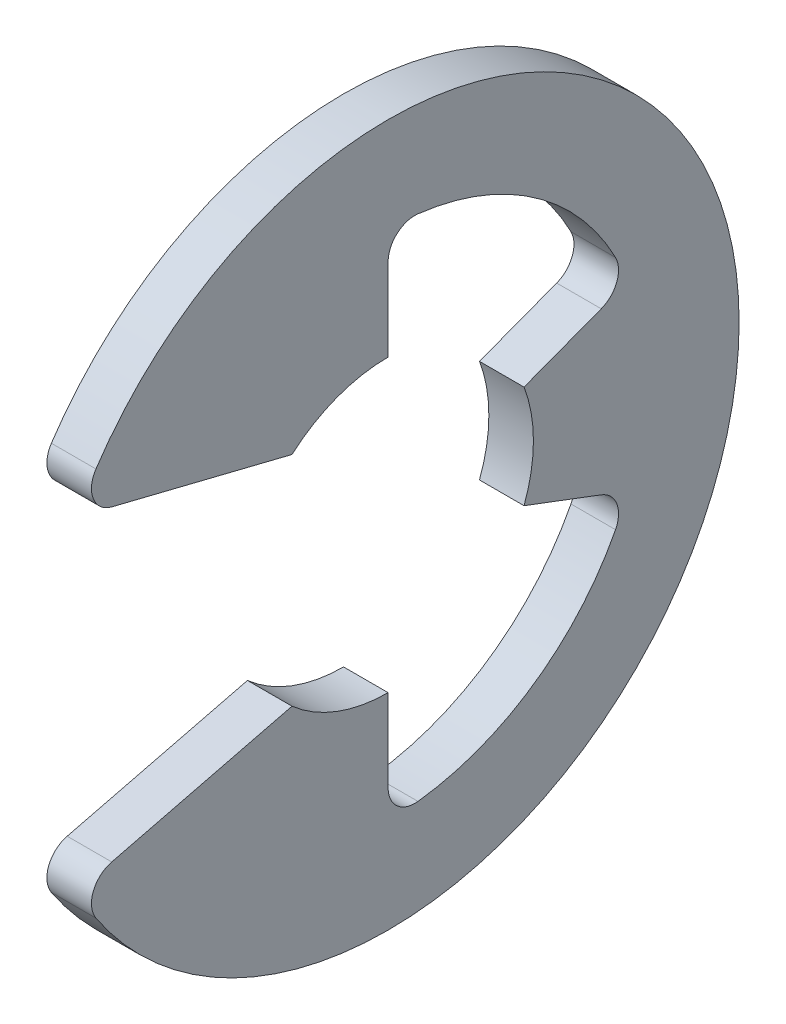
from build123d import *

# Parameters (mm, degrees)
EXTRUDE1_DEPTH = 0.5
FILLET1_R      = 0.6


with BuildPart() as part:
    # Sketch1 → Extrude1 (new, symmetric)
    with BuildSketch(Plane(origin=(0, 0, 0), x_dir=(0, 0, -1), z_dir=(1, 0, 0))):
        with BuildLine():
            Line((-6.981705618, -3.642994877), (-2.156287319, -2.445))
            ThreePointArc((-2.156287319, -2.445), (-1.152584053, -3.04945077), (0, -3.26))
            Line((0, -3.26), (0, -5.747096774))
            ThreePointArc((0, -5.747096774), (3.267381482, -4.727931851), (5.375916774, -2.031905551))
            Line((5.375916774, -2.031905551), (3.04945077, -1.152584053))
            ThreePointArc((3.04945077, -1.152584053), (3.26, 0), (3.04945077, 1.152584053))
            Line((3.04945077, 1.152584053), (5.375916774, 2.031905551))
            ThreePointArc((5.375916774, 2.031905551), (3.267381482, 4.727931851), (0, 5.747096774))
            Line((0, 5.747096774), (0, 3.26))
            ThreePointArc((0, 3.26), (-1.152584053, 3.04945077), (-2.156287319, 2.445))
            Line((-2.156287319, 2.445), (-6.981705618, 3.642994877))
            ThreePointArc((-6.981705618, 3.642994877), (7.875, 0), (-6.981705618, -3.642994877))
        make_face()
    extrude(amount=EXTRUDE1_DEPTH, both=True)

    # Fillet1
    fillet1_edges = [part.edges().sort_by_distance(p)[0] for p in [
        (0, -3.642994877, 6.981705618),
        (0, -5.747096774, 0),
        (0, -2.031905551, -5.375916774),
        (0, 2.031905551, -5.375916774),
        (0, 5.747096774, 0),
        (0, 3.642994877, 6.981705618),
    ]]
    fillet(fillet1_edges, radius=FILLET1_R)


solid = part.part
